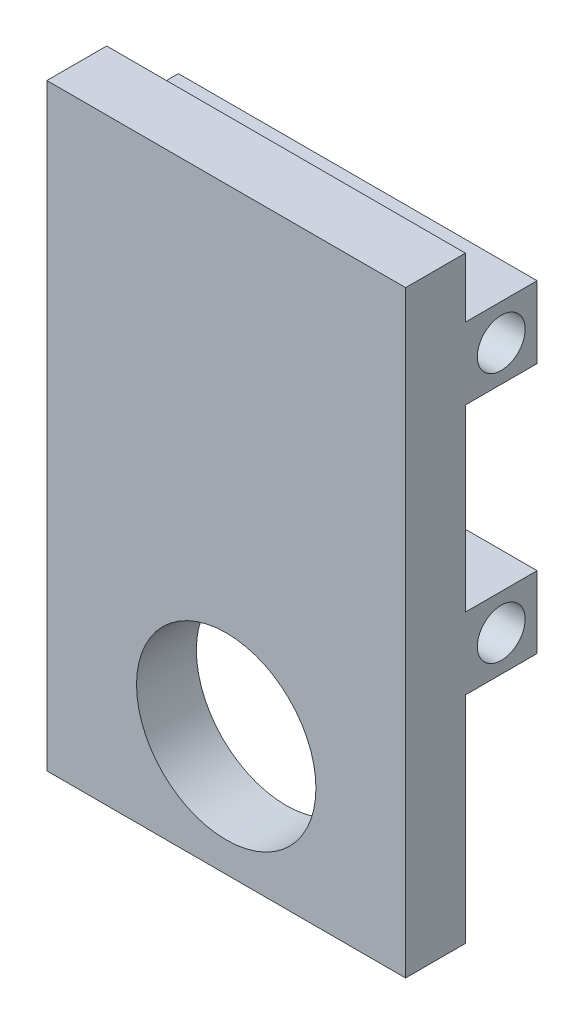
from build123d import *

# Parameters (mm, degrees)
SKETCH_1_R          = 4
EXTRUDE_1_DEPTH     = 60
SKETCH_2_R          = 15
CUT_EXTRUDE_1_DEPTH = 60


with BuildPart() as part:
    # 草图1 → 凸台-拉伸1 (new body)
    with BuildSketch(Plane(origin=(0, 0, 0), x_dir=(0, 0, -1), z_dir=(1, 0, 0))):
        Polygon((5, -2), (5, 28), (17, 28), (17, 40), (5, 40), (5, 50), (-5, 50), (-5, -50), (5, -50), (5, -14), (17, -14), (17, -2), align=None)
        with Locations((11, 34)):
            Circle(SKETCH_1_R, mode=Mode.SUBTRACT)
        with Locations((11, -8)):
            Circle(SKETCH_1_R, mode=Mode.SUBTRACT)
    extrude(amount=EXTRUDE_1_DEPTH)

    # 草图2 → 切除-拉伸1 (cut)
    with BuildSketch(Plane.XY.offset(5)):
        with Locations((30, -30)):
            Circle(SKETCH_2_R)
    extrude(amount=-CUT_EXTRUDE_1_DEPTH, mode=Mode.SUBTRACT)


solid = part.part
